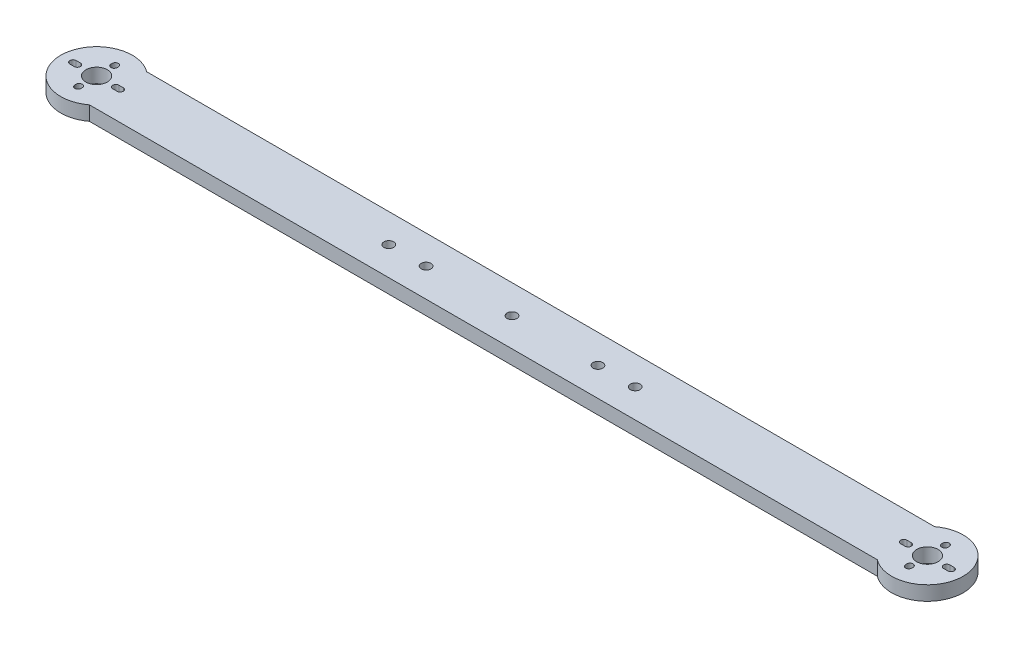
from build123d import *

# Parameters (mm, degrees)
BOSS_EXTRUDE1_DEPTH = 6.35
SKETCH2_R           = 4.75
CUT_EXTRUDE1_DEPTH  = 201.754423986
SKETCH3_R           = 2.159
CUT_EXTRUDE2_DEPTH  = 201.754423986
SKETCH4_R           = 2.159
CUT_EXTRUDE3_DEPTH  = 201.754423986


with BuildPart() as part:
    # Sketch1 → Boss-Extrude1 (new body)
    with BuildSketch(Plane(origin=(0, 0, 0), x_dir=(1, 0, 0), z_dir=(0, 1, 0))):
        with BuildLine():
            Line((-174.625, 12.7), (174.625, 12.7))
            ThreePointArc((174.625, 12.7), (200.025, 0), (174.625, -12.7))
            Line((174.625, -12.7), (-174.625, -12.7))
            ThreePointArc((-174.625, -12.7), (-200.025, 0), (-174.625, 12.7))
        make_face()
    extrude(amount=BOSS_EXTRUDE1_DEPTH)

    # Sketch2 → Cut-Extrude1 (cut, through all)
    with BuildSketch(Plane(origin=(0, 6.35, 0), x_dir=(1, 0, 0), z_dir=(0, 1, 0))):
        with Locations(Location((184.15, 0, 0), (0, 0, 270))):
            Circle(SKETCH2_R)
        with Locations(Location((-184.15, 0, 0), (0, 0, 90))):
            Circle(SKETCH2_R)
        with BuildLine():
            Line((173.691383345, 1.375), (175.608616655, 1.375))
            ThreePointArc((175.608616655, 1.375), (176.983616655, 0), (175.608616655, -1.375))
            Line((175.608616655, -1.375), (173.691383345, -1.375))
            ThreePointArc((173.691383345, -1.375), (172.316383345, 0), (173.691383345, 1.375))
        make_face()
        with BuildLine():
            Line((194.608616655, 1.375), (192.691383345, 1.375))
            ThreePointArc((192.691383345, 1.375), (191.316383345, 0), (192.691383345, -1.375))
            Line((192.691383345, -1.375), (194.608616655, -1.375))
            ThreePointArc((194.608616655, -1.375), (195.983616655, 0), (194.608616655, 1.375))
        make_face()
        with BuildLine():
            Line((185.525, 8.25), (185.525, 7.75))
            ThreePointArc((185.525, 7.75), (184.15, 6.375), (182.775, 7.75))
            Line((182.775, 7.75), (182.775, 8.25))
            ThreePointArc((182.775, 8.25), (184.15, 9.625), (185.525, 8.25))
        make_face()
        with BuildLine():
            Line((185.525, -8.25), (185.525, -7.75))
            ThreePointArc((185.525, -7.75), (184.15, -6.375), (182.775, -7.75))
            Line((182.775, -7.75), (182.775, -8.25))
            ThreePointArc((182.775, -8.25), (184.15, -9.625), (185.525, -8.25))
        make_face()
        with BuildLine():
            Line((-185.525, -8.25), (-185.525, -7.75))
            ThreePointArc((-185.525, -7.75), (-184.15, -6.375), (-182.775, -7.75))
            Line((-182.775, -7.75), (-182.775, -8.25))
            ThreePointArc((-182.775, -8.25), (-184.15, -9.625), (-185.525, -8.25))
        make_face()
        with BuildLine():
            Line((-185.525, 8.25), (-185.525, 7.75))
            ThreePointArc((-185.525, 7.75), (-184.15, 6.375), (-182.775, 7.75))
            Line((-182.775, 7.75), (-182.775, 8.25))
            ThreePointArc((-182.775, 8.25), (-184.15, 9.625), (-185.525, 8.25))
        make_face()
        with BuildLine():
            Line((-194.608616655, 1.375), (-192.691383345, 1.375))
            ThreePointArc((-192.691383345, 1.375), (-191.316383345, 0), (-192.691383345, -1.375))
            Line((-192.691383345, -1.375), (-194.608616655, -1.375))
            ThreePointArc((-194.608616655, -1.375), (-195.983616655, 0), (-194.608616655, 1.375))
        make_face()
        with BuildLine():
            Line((-173.691383345, 1.375), (-175.608616655, 1.375))
            ThreePointArc((-175.608616655, 1.375), (-176.983616655, 0), (-175.608616655, -1.375))
            Line((-175.608616655, -1.375), (-173.691383345, -1.375))
            ThreePointArc((-173.691383345, -1.375), (-172.316383345, 0), (-173.691383345, 1.375))
        make_face()
    extrude(amount=-CUT_EXTRUDE1_DEPTH, mode=Mode.SUBTRACT)

    # Sketch3 → Cut-Extrude2 (cut, through all)
    with BuildSketch(Plane(origin=(0, 6.35, 0), x_dir=(1, 0, 0), z_dir=(0, 1, 0))):
        with Locations(Location((0, 0, 0), (0, 0, 270))):
            Circle(SKETCH3_R)
        with Locations(Location((38.1, 0, 0), (0, 0, 270))):
            Circle(SKETCH3_R)
        with Locations(Location((-38.1, 0, 0), (0, 0, 270))):
            Circle(SKETCH3_R)
    extrude(amount=-CUT_EXTRUDE2_DEPTH, mode=Mode.SUBTRACT)

    # Sketch4 → Cut-Extrude3 (cut, through all)
    with BuildSketch(Plane(origin=(0, 6.35, 0), x_dir=(1, 0, 0), z_dir=(0, 1, 0))):
        with Locations(Location((54.61, 0, 0), (0, 0, 270))):
            Circle(SKETCH4_R)
        with Locations(Location((-54.61, 0, 0), (0, 0, 90))):
            Circle(SKETCH4_R)
    extrude(amount=-CUT_EXTRUDE3_DEPTH, mode=Mode.SUBTRACT)


solid = part.part
